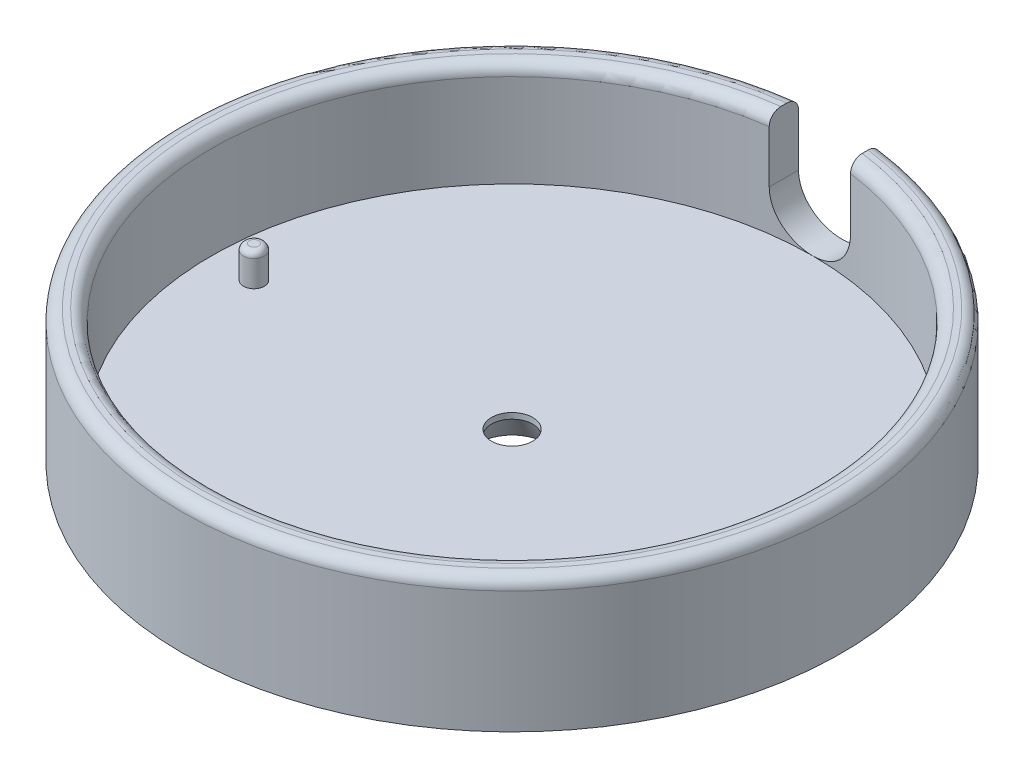
from build123d import *

# Parameters (mm, degrees)
SKETCH1_R               = 56.75
BOSS_EXTRUDE3_DEPTH     = 23
SKETCH10_R              = 51.75
CUT_EXTRUDE3_DEPTH      = 18
SKETCH12_R              = 3.55
CUT_EXTRUDE4_DEPTH      = 83.250379938
SKETCH17_R              = 1.8
BOSS_EXTRUDE4_DEPTH     = 5.5
SKETCH18_R              = 1.8
BOSS_EXTRUDE5_DEPTH     = 5.5
FILLET5_R               = 1
FILLET6_R               = 1
CUT_EXTRUDE5_DEPTH      = 3
CUT_EXTRUDE5_DEPTH_BACK = 3
FILLET7_R               = 2
FILLET8_R               = 2
CHAMFER1_SIZE           = 4
CHAMFER1_SIZE2          = 2.309401077


with BuildPart() as part:
    # Sketch1 → Boss-Extrude3 (new body)
    with BuildSketch(Plane(origin=(0, 0, 0), x_dir=(1, 0, 0), z_dir=(0, 1, 0))):
        Circle(SKETCH1_R)
    extrude(amount=BOSS_EXTRUDE3_DEPTH)

    # Sketch10 → Cut-Extrude3 (cut)
    with BuildSketch(Plane(origin=(0, 23, 0), x_dir=(1, 0, 0), z_dir=(0, 1, 0))):
        Circle(SKETCH10_R)
    extrude(amount=-CUT_EXTRUDE3_DEPTH, mode=Mode.SUBTRACT)

    # Sketch12 → Cut-Extrude4 (cut, through all)
    with BuildSketch(Plane(origin=(0, 5, 0), x_dir=(1, 0, 0), z_dir=(0, 1, 0))):
        Circle(SKETCH12_R)
    extrude(amount=-CUT_EXTRUDE4_DEPTH, mode=Mode.SUBTRACT)

    # Sketch17 → Boss-Extrude4 (add)
    with BuildSketch(Plane(origin=(0, 5, 0), x_dir=(1, 0, 0), z_dir=(0, 1, 0))):
        with Locations((-44.45, 0)):
            Circle(SKETCH17_R)
    extrude(amount=BOSS_EXTRUDE4_DEPTH)

    # Sketch18 → Boss-Extrude5 (add)
    with BuildSketch(Plane(origin=(0, 5, 0), x_dir=(1, 0, 0), z_dir=(0, 1, 0))):
        with Locations((44.45, 0)):
            Circle(SKETCH18_R)
    extrude(amount=BOSS_EXTRUDE5_DEPTH)

    # Fillet5
    fillet5_edges = [part.edges().sort_by_distance(p)[0] for p in [
        (-46.25, 10.5, 0),
    ]]
    fillet(fillet5_edges, radius=FILLET5_R)

    # Fillet6
    fillet6_edges = [part.edges().sort_by_distance(p)[0] for p in [
        (42.65, 10.5, 0),
    ]]
    fillet(fillet6_edges, radius=FILLET6_R)

    # Sketch27 → Cut-Extrude5 (cut, two sides: drawn at the far end of the back side and taken through both)
    with BuildSketch(Plane.XY.offset(-54.25).offset(-CUT_EXTRUDE5_DEPTH_BACK)):
        with BuildLine():
            Line((7, 23), (7, 12))
            ThreePointArc((7, 12), (0, 5), (-7, 12))
            Line((-7, 12), (-7, 23))
            ThreePointArc((-7, 23), (0, 30), (7, 23))
        make_face()
    extrude(amount=CUT_EXTRUDE5_DEPTH + CUT_EXTRUDE5_DEPTH_BACK, mode=Mode.SUBTRACT)

    # Fillet7
    fillet7_edges = [part.edges().sort_by_distance(p)[0] for p in [
        (-34.028021541, 23, 38.989181192),
    ]]
    fillet(fillet7_edges, radius=FILLET7_R)

    # Fillet8
    fillet8_edges = [part.edges().sort_by_distance(p)[0] for p in [
        (-37.572014186, 23, 42.531238519),
    ]]
    fillet(fillet8_edges, radius=FILLET8_R)

    # Chamfer1
    chamfer1_edges = [part.edges().sort_by_distance(p)[0] for p in [
        (-3.55, 0, 0),
    ]]
    chamfer1_side = [part.faces().sort_by_distance(p)[0] for p in [
        (-3.55, 2.5, 0),
    ]]
    chamfer(chamfer1_edges, length=CHAMFER1_SIZE, length2=CHAMFER1_SIZE2, reference=chamfer1_side[0])


solid = part.part
